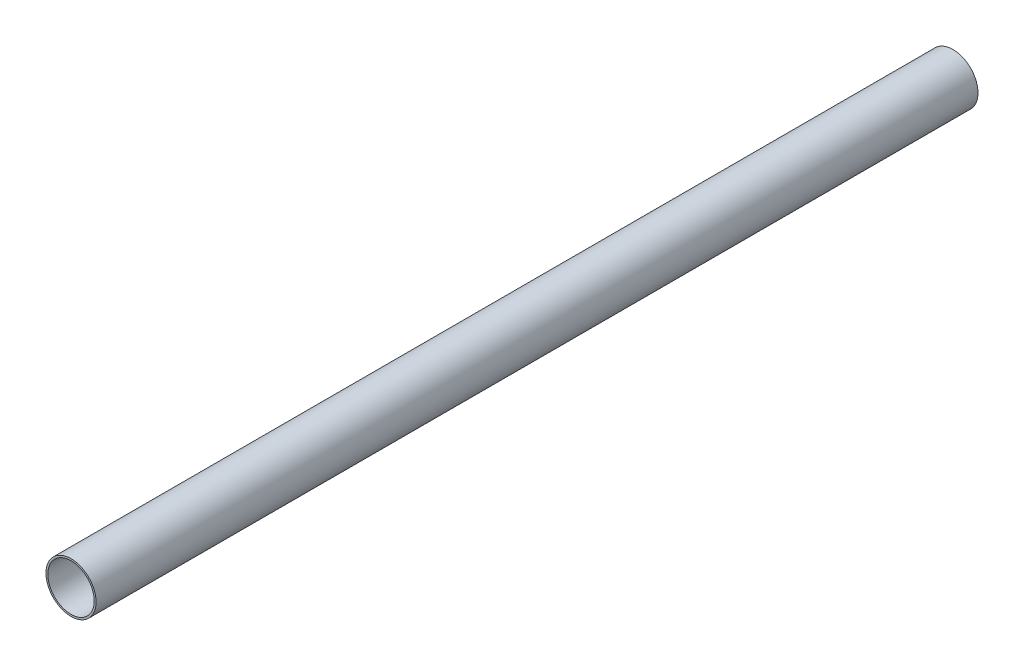
from build123d import *

# Parameters (mm, degrees)
SKETCH1_R              = 54
SKETCH1_R_2            = 50
MEMBER_108_X_4_1_DEPTH = 1900


with BuildPart() as part:
    # Sketch1 → Member 108 X 4_1 (new body)
    with BuildSketch(Plane.YX):
        Circle(SKETCH1_R)
        Circle(SKETCH1_R_2, mode=Mode.SUBTRACT)
    extrude(amount=MEMBER_108_X_4_1_DEPTH)


solid = part.part
